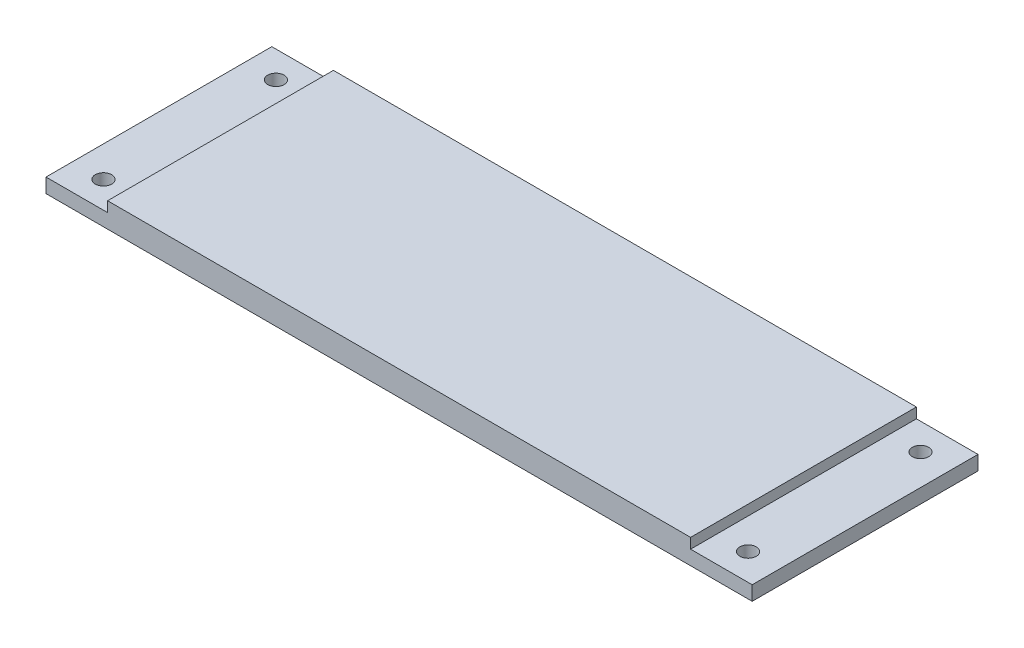
from build123d import *

# Parameters (mm, degrees)
ESQUISSE1_W             = 172
ESQUISSE1_H             = 55
BOSS_EXTRU_1_DEPTH      = 3.5
ESQUISSE2_R             = 2
ENL_V_MAT_EXTRU_1_DEPTH = 6
ESQUISSE3_W             = 142
ESQUISSE3_H             = 55
BOSS_EXTRU_2_DEPTH      = 2.5


with BuildPart() as part:
    # Esquisse1 → Boss.-Extru.1 (new body)
    with BuildSketch(Plane(origin=(0, 0, 0), x_dir=(1, 0, 0), z_dir=(0, 1, 0))):
        Rectangle(ESQUISSE1_W, ESQUISSE1_H)
    extrude(amount=BOSS_EXTRU_1_DEPTH)

    # Esquisse2 → Enlèv. mat.-Extru.1 (cut)
    with BuildSketch(Plane(origin=(0, 3.5, 0), x_dir=(1, 0, 0), z_dir=(0, 1, 0))):
        with Locations(Location((-78.5, 21, 0), (0, 0, 270))):
            Circle(ESQUISSE2_R)
        with Locations(Location((-78.5, -21, 0), (0, 0, 270))):
            Circle(ESQUISSE2_R)
        with Locations(Location((78.5, -21, 0), (0, 0, 270))):
            Circle(ESQUISSE2_R)
        with Locations(Location((78.5, 21, 0), (0, 0, 270))):
            Circle(ESQUISSE2_R)
    extrude(amount=-ENL_V_MAT_EXTRU_1_DEPTH, mode=Mode.SUBTRACT)

    # Esquisse3 → Boss.-Extru.2 (add)
    with BuildSketch(Plane(origin=(0, 3.5, 0), x_dir=(1, 0, 0), z_dir=(0, 1, 0))):
        Rectangle(ESQUISSE3_W, ESQUISSE3_H)
    extrude(amount=BOSS_EXTRU_2_DEPTH)


solid = part.part
